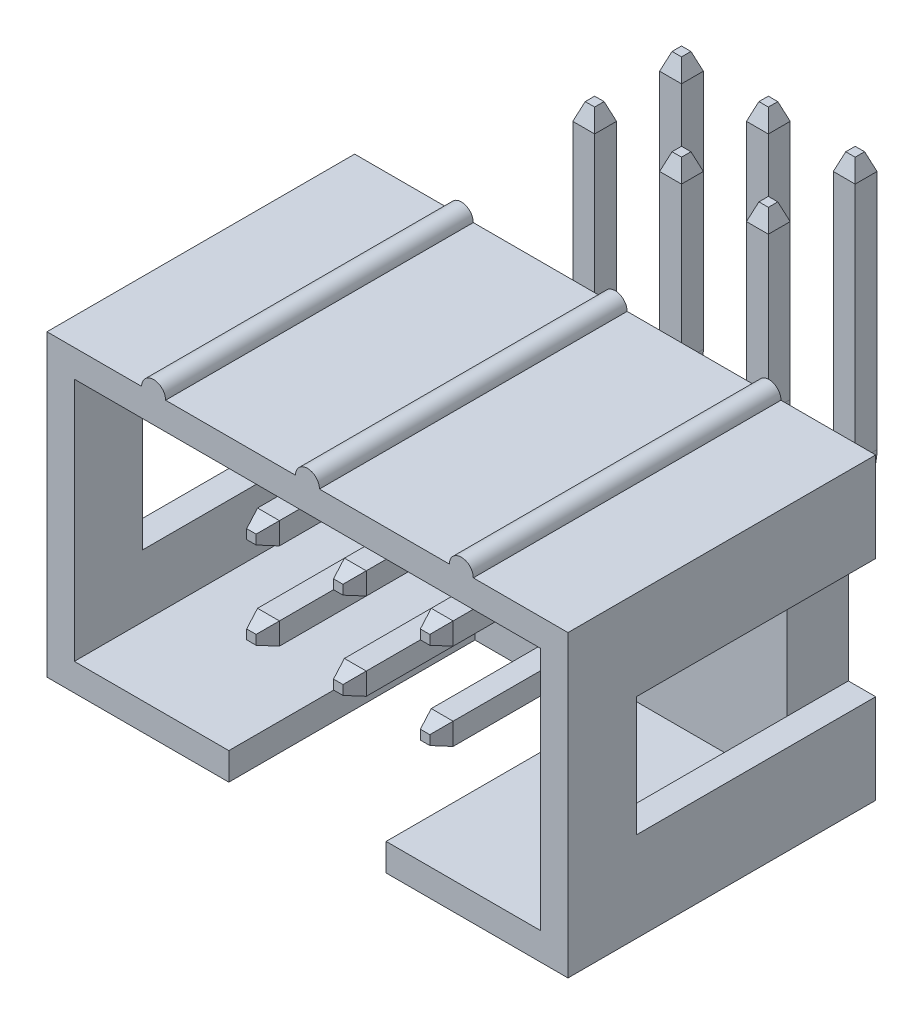
from build123d import *
from OCP.BRepFilletAPI import BRepFilletAPI_MakeChamfer

# Parameters (mm, degrees)
SKETCH_1_W             = 15.24
SKETCH_1_H             = 8.75
EXTRUDE_1_DEPTH        = 1.8
SKETCH_2_W             = 15.24
SKETCH_2_H             = 8.75
SKETCH_2_W_2           = 13.64
SKETCH_2_H_2           = 7.15
EXTRUDE_2_DEPTH        = 7.2
CUT_EXTRUDE_START      = -1.8
SKETCH_3_W             = 0.8
SKETCH_3_H             = 3.5
CUT_EXTRUDE_1_DEPTH    = 7
SKETCH_4_W             = 4.6
SKETCH_4_H             = 0.8
CUT_EXTRUDE_2_DEPTH    = 7.2
CUT_EXTRUDE_3_DEPTH    = 0.1
SKETCH_8_W             = 0.64
SKETCH_8_H             = 0.64
SKETCH_5_W             = 0.64
SKETCH_5_H             = 0.64
CHAMFER_16_SIZE        = 0.5
CHAMFER_16_SIZE2       = 0.181985117
CHAMFER_17_SIZE        = 0.5
CHAMFER_17_SIZE2       = 0.181985117
CHAMFER_18_SIZE        = 0.5
CHAMFER_18_SIZE2       = 0.181985117
CHAMFER_19_SIZE        = 0.5
CHAMFER_19_SIZE2       = 0.181985117
PATTERN_LINEAR_2_COUNT = 2
PATTERN_LINEAR_2_PITCH = 2.54
PATTERN_LINEAR_3_COUNT = 2
PATTERN_LINEAR_3_PITCH = 2.54
SKETCH_10_R            = 0.35
EXTRUDE_3_DEPTH        = 9


with BuildPart() as part:
    # Эскиз1 → Бобышка-Вытянуть1 (new body)
    with BuildSketch(Plane.XY):
        Rectangle(SKETCH_1_W, SKETCH_1_H)
    extrude(amount=EXTRUDE_1_DEPTH)

    # Эскиз2 → Бобышка-Вытянуть2 (add)
    with BuildSketch(Plane.XY.offset(1.8)):
        Rectangle(SKETCH_2_W, SKETCH_2_H)
        Rectangle(SKETCH_2_W_2, SKETCH_2_H_2, mode=Mode.SUBTRACT)
    extrude(amount=EXTRUDE_2_DEPTH)

    # Эскиз3 → Вырез-Вытянуть1 (cut)
    with BuildSketch(Plane.XY.offset(1.8).offset(CUT_EXTRUDE_START)):
        with Locations((7.22, 0)):
            Rectangle(SKETCH_3_W, SKETCH_3_H)
        with Locations((-7.22, 0)):
            Rectangle(SKETCH_3_W, SKETCH_3_H)
    extrude(amount=CUT_EXTRUDE_1_DEPTH, mode=Mode.SUBTRACT)

    # Эскиз4 → Вырез-Вытянуть2 (cut)
    with BuildSketch(Plane.XY.offset(9)):
        with Locations((0, -3.975)):
            Rectangle(SKETCH_4_W, SKETCH_4_H)
    extrude(amount=-CUT_EXTRUDE_2_DEPTH, mode=Mode.SUBTRACT)

    # Эскиз6 → Вырез-Вытянуть3 (cut)
    with BuildSketch(Plane.XZ.offset(4.375)):
        Polygon((-4.976440372, 5.189720174), (-3.184624847, 5.189720174), (-4.08053261, 3.716247509), align=None)
    extrude(amount=-CUT_EXTRUDE_3_DEPTH, mode=Mode.SUBTRACT)



with BuildPart() as body_2:
    # По траектории2: sweep along a path in Эскиз9
    with BuildLine(Plane.ZY) as sweep_2_path:
        Line((8.1, -1.27), (0, -1.27))
        Line((0, -1.27), (-3.48, -1.27))
        ThreePointArc((-3.48, -1.27), (-4.187106781, -0.977106781), (-4.48, -0.27))
        Line((-4.48, -0.27), (-4.48, 7.275))
    # Эскиз8 → По траектории2 (sweep)
    with BuildSketch(Plane.XY):
        with Locations((0, -1.27)):
            Rectangle(SKETCH_8_W, SKETCH_8_H)
    sweep(path=sweep_2_path.line)

    # Фаска17: one chamfer whose edges measure the first distance from different faces: ONE call of the kernel's chamfer builder (chamfer() names one face for all edges)
    chamfer_17_edges_1 = [body_2.edges().sort_by_distance(p)[0] for p in [
        (0, 7.275, -4.16),
    ]]
    chamfer_17_side_1 = [body_2.faces().sort_by_distance(p)[0] for p in [
        (0, 3.5025, -4.16),
    ]]
    chamfer_17_edges_2 = [body_2.edges().sort_by_distance(p)[0] for p in [
        (-0.32, 7.275, -4.48),
    ]]
    chamfer_17_side_2 = [body_2.faces().sort_by_distance(p)[0] for p in [
        (-0.32, -1.27, 7.943475809),
    ]]
    chamfer_17_edges_3 = [body_2.edges().sort_by_distance(p)[0] for p in [
        (0, 7.275, -4.8),
    ]]
    chamfer_17_side_3 = [body_2.faces().sort_by_distance(p)[0] for p in [
        (0, 3.5025, -4.8),
    ]]
    chamfer_17_edges_4 = [body_2.edges().sort_by_distance(p)[0] for p in [
        (0.32, 7.275, -4.48),
    ]]
    chamfer_17_side_4 = [body_2.faces().sort_by_distance(p)[0] for p in [
        (0.32, -1.27, 7.943475809),
    ]]
    chamfer_17 = BRepFilletAPI_MakeChamfer(body_2.part.solid().wrapped)
    for e in chamfer_17_edges_1:
        chamfer_17.Add(CHAMFER_17_SIZE, CHAMFER_17_SIZE2, e.wrapped, chamfer_17_side_1[0].wrapped)  # the first distance lies on this face
    for e in chamfer_17_edges_2:
        chamfer_17.Add(CHAMFER_17_SIZE, CHAMFER_17_SIZE2, e.wrapped, chamfer_17_side_2[0].wrapped)  # the first distance lies on this face
    for e in chamfer_17_edges_3:
        chamfer_17.Add(CHAMFER_17_SIZE, CHAMFER_17_SIZE2, e.wrapped, chamfer_17_side_3[0].wrapped)  # the first distance lies on this face
    for e in chamfer_17_edges_4:
        chamfer_17.Add(CHAMFER_17_SIZE, CHAMFER_17_SIZE2, e.wrapped, chamfer_17_side_4[0].wrapped)  # the first distance lies on this face
    add(Compound.cast(chamfer_17.Shape()), mode=Mode.REPLACE)

    # Фаска18: one chamfer whose edges measure the first distance from different faces: ONE call of the kernel's chamfer builder (chamfer() names one face for all edges)
    chamfer_18_edges_1 = [body_2.edges().sort_by_distance(p)[0] for p in [
        (0.32, -1.27, 8.1),
    ]]
    chamfer_18_side_1 = [body_2.faces().sort_by_distance(p)[0] for p in [
        (0.32, 3.2525, -4.313747593),
    ]]
    chamfer_18_edges_2 = [body_2.edges().sort_by_distance(p)[0] for p in [
        (0, -0.95, 8.1),
    ]]
    chamfer_18_side_2 = [body_2.faces().sort_by_distance(p)[0] for p in [
        (0, -0.95, 2.31),
    ]]
    chamfer_18_edges_3 = [body_2.edges().sort_by_distance(p)[0] for p in [
        (-0.32, -1.27, 8.1),
    ]]
    chamfer_18_side_3 = [body_2.faces().sort_by_distance(p)[0] for p in [
        (-0.32, 3.2525, -4.646252407),
    ]]
    chamfer_18_edges_4 = [body_2.edges().sort_by_distance(p)[0] for p in [
        (0, -1.59, 8.1),
    ]]
    chamfer_18_side_4 = [body_2.faces().sort_by_distance(p)[0] for p in [
        (0, -1.59, 2.31),
    ]]
    chamfer_18 = BRepFilletAPI_MakeChamfer(body_2.part.solid().wrapped)
    for e in chamfer_18_edges_1:
        chamfer_18.Add(CHAMFER_18_SIZE, CHAMFER_18_SIZE2, e.wrapped, chamfer_18_side_1[0].wrapped)  # the first distance lies on this face
    for e in chamfer_18_edges_2:
        chamfer_18.Add(CHAMFER_18_SIZE, CHAMFER_18_SIZE2, e.wrapped, chamfer_18_side_2[0].wrapped)  # the first distance lies on this face
    for e in chamfer_18_edges_3:
        chamfer_18.Add(CHAMFER_18_SIZE, CHAMFER_18_SIZE2, e.wrapped, chamfer_18_side_3[0].wrapped)  # the first distance lies on this face
    for e in chamfer_18_edges_4:
        chamfer_18.Add(CHAMFER_18_SIZE, CHAMFER_18_SIZE2, e.wrapped, chamfer_18_side_4[0].wrapped)  # the first distance lies on this face
    add(Compound.cast(chamfer_18.Shape()), mode=Mode.REPLACE)


with BuildPart() as body_3:
    # По траектории3: sweep along a path in Эскиз7
    with BuildLine(Plane(origin=(0, 0, 0), x_dir=(0, 0, -1), z_dir=(1, 0, 0))) as sweep_3_path:
        Line((-8.1, 1.27), (-1.8, 1.27))
        Line((-1.8, 1.27), (0.94, 1.27))
        ThreePointArc((0.94, 1.27), (1.647106781, 1.562893219), (1.94, 2.27))
        Line((1.94, 2.27), (1.94, 7.275))
    # Эскиз5 → По траектории3 (sweep)
    with BuildSketch(Plane.XY.offset(1.8)):
        with Locations((0, 1.27)):
            Rectangle(SKETCH_5_W, SKETCH_5_H)
    sweep(path=sweep_3_path.line)

    # Фаска16: one chamfer whose edges measure the first distance from different faces: ONE call of the kernel's chamfer builder (chamfer() names one face for all edges)
    chamfer_16_edges_1 = [body_3.edges().sort_by_distance(p)[0] for p in [
        (0, 7.275, -1.62),
    ]]
    chamfer_16_side_1 = [body_3.faces().sort_by_distance(p)[0] for p in [
        (0, 4.7725, -1.62),
    ]]
    chamfer_16_edges_2 = [body_3.edges().sort_by_distance(p)[0] for p in [
        (-0.32, 7.275, -1.94),
    ]]
    chamfer_16_side_2 = [body_3.faces().sort_by_distance(p)[0] for p in [
        (-0.32, 1.27, 7.978618278),
    ]]
    chamfer_16_edges_3 = [body_3.edges().sort_by_distance(p)[0] for p in [
        (0, 7.275, -2.26),
    ]]
    chamfer_16_side_3 = [body_3.faces().sort_by_distance(p)[0] for p in [
        (0, 4.7725, -2.26),
    ]]
    chamfer_16_edges_4 = [body_3.edges().sort_by_distance(p)[0] for p in [
        (0.32, 7.275, -1.94),
    ]]
    chamfer_16_side_4 = [body_3.faces().sort_by_distance(p)[0] for p in [
        (0.32, 1.27, 7.978618278),
    ]]
    chamfer_16 = BRepFilletAPI_MakeChamfer(body_3.part.solid().wrapped)
    for e in chamfer_16_edges_1:
        chamfer_16.Add(CHAMFER_16_SIZE, CHAMFER_16_SIZE2, e.wrapped, chamfer_16_side_1[0].wrapped)  # the first distance lies on this face
    for e in chamfer_16_edges_2:
        chamfer_16.Add(CHAMFER_16_SIZE, CHAMFER_16_SIZE2, e.wrapped, chamfer_16_side_2[0].wrapped)  # the first distance lies on this face
    for e in chamfer_16_edges_3:
        chamfer_16.Add(CHAMFER_16_SIZE, CHAMFER_16_SIZE2, e.wrapped, chamfer_16_side_3[0].wrapped)  # the first distance lies on this face
    for e in chamfer_16_edges_4:
        chamfer_16.Add(CHAMFER_16_SIZE, CHAMFER_16_SIZE2, e.wrapped, chamfer_16_side_4[0].wrapped)  # the first distance lies on this face
    add(Compound.cast(chamfer_16.Shape()), mode=Mode.REPLACE)

    # Фаска19: one chamfer whose edges measure the first distance from different faces: ONE call of the kernel's chamfer builder (chamfer() names one face for all edges)
    chamfer_19_edges_1 = [body_3.edges().sort_by_distance(p)[0] for p in [
        (0.32, 1.27, 8.1),
    ]]
    chamfer_19_side_1 = [body_3.faces().sort_by_distance(p)[0] for p in [
        (0.32, 4.5225, -1.738852945),
    ]]
    chamfer_19_edges_2 = [body_3.edges().sort_by_distance(p)[0] for p in [
        (0, 1.59, 8.1),
    ]]
    chamfer_19_side_2 = [body_3.faces().sort_by_distance(p)[0] for p in [
        (0, 1.59, 3.58),
    ]]
    chamfer_19_edges_3 = [body_3.edges().sort_by_distance(p)[0] for p in [
        (-0.32, 1.27, 8.1),
    ]]
    chamfer_19_side_3 = [body_3.faces().sort_by_distance(p)[0] for p in [
        (-0.32, 4.5225, -2.141147055),
    ]]
    chamfer_19_edges_4 = [body_3.edges().sort_by_distance(p)[0] for p in [
        (0, 0.95, 8.1),
    ]]
    chamfer_19_side_4 = [body_3.faces().sort_by_distance(p)[0] for p in [
        (0, 0.95, 3.58),
    ]]
    chamfer_19 = BRepFilletAPI_MakeChamfer(body_3.part.solid().wrapped)
    for e in chamfer_19_edges_1:
        chamfer_19.Add(CHAMFER_19_SIZE, CHAMFER_19_SIZE2, e.wrapped, chamfer_19_side_1[0].wrapped)  # the first distance lies on this face
    for e in chamfer_19_edges_2:
        chamfer_19.Add(CHAMFER_19_SIZE, CHAMFER_19_SIZE2, e.wrapped, chamfer_19_side_2[0].wrapped)  # the first distance lies on this face
    for e in chamfer_19_edges_3:
        chamfer_19.Add(CHAMFER_19_SIZE, CHAMFER_19_SIZE2, e.wrapped, chamfer_19_side_3[0].wrapped)  # the first distance lies on this face
    for e in chamfer_19_edges_4:
        chamfer_19.Add(CHAMFER_19_SIZE, CHAMFER_19_SIZE2, e.wrapped, chamfer_19_side_4[0].wrapped)  # the first distance lies on this face
    add(Compound.cast(chamfer_19.Shape()), mode=Mode.REPLACE)


with BuildPart() as pattern_linear_2_1:
    # Линейный массив2: pattern copy
    add(body_2.part.moved(Location(Vector(1, 0, 0) * (1 * PATTERN_LINEAR_2_PITCH))))


with BuildPart() as pattern_linear_2_2:
    # Линейный массив2: pattern copy
    add(body_3.part.moved(Location(Vector(1, 0, 0) * (1 * PATTERN_LINEAR_2_PITCH))))


with BuildPart() as pattern_linear_3_1:
    # Линейный массив3: pattern copy
    add(body_2.part.moved(Location(Vector(-1, 0, 0) * (1 * PATTERN_LINEAR_3_PITCH))))


with BuildPart() as pattern_linear_3_2:
    # Линейный массив3: pattern copy
    add(body_3.part.moved(Location(Vector(-1, 0, 0) * (1 * PATTERN_LINEAR_3_PITCH))))


with BuildPart() as part_1:
    add(part.part)

    add(body_2.part)  # Бобышка-Вытянуть3 merges body 2

    add(body_3.part)  # Бобышка-Вытянуть3 merges body 3
    # Эскиз10 → Бобышка-Вытянуть3 (add)
    with BuildSketch(Plane(origin=(0, -4.625, 9), x_dir=(1, 0, 0), z_dir=(0, 0, -1))):
        with Locations((0, -9)):
            Circle(SKETCH_10_R)
        with Locations((4.5, -9)):
            Circle(SKETCH_10_R)
        with Locations((-4.5, -9)):
            Circle(SKETCH_10_R)
    extrude(amount=EXTRUDE_3_DEPTH)


solid = Compound([pattern_linear_2_1.part, pattern_linear_2_2.part, pattern_linear_3_1.part, pattern_linear_3_2.part, part_1.part])
